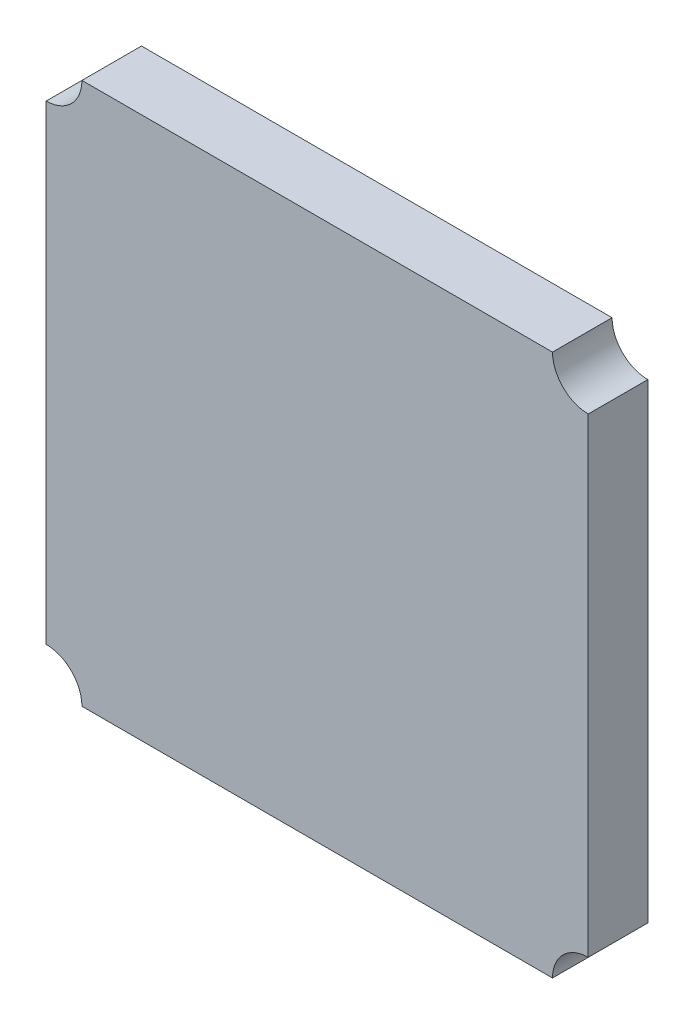
from build123d import *

# Parameters (mm, degrees)
BOSS_EXTRU_1_DEPTH = 5


with BuildPart() as part:
    # Esquisse1 → Boss.-Extru.1 (new body)
    with BuildSketch(Plane.XY):
        with BuildLine():
            Line((42.5, 0), (3, 0))
            ThreePointArc((3, 0), (2.121320344, -2.121320344), (0, -3))
            Line((0, -3), (0, -42.5))
            ThreePointArc((0, -42.5), (2.121320344, -43.378679656), (3, -45.5))
            Line((3, -45.5), (42.5, -45.5))
            ThreePointArc((42.5, -45.5), (43.378679656, -43.378679656), (45.5, -42.5))
            Line((45.5, -42.5), (45.5, -3))
            ThreePointArc((45.5, -3), (43.378679656, -2.121320344), (42.5, 0))
        make_face()
    extrude(amount=BOSS_EXTRU_1_DEPTH)


solid = part.part
